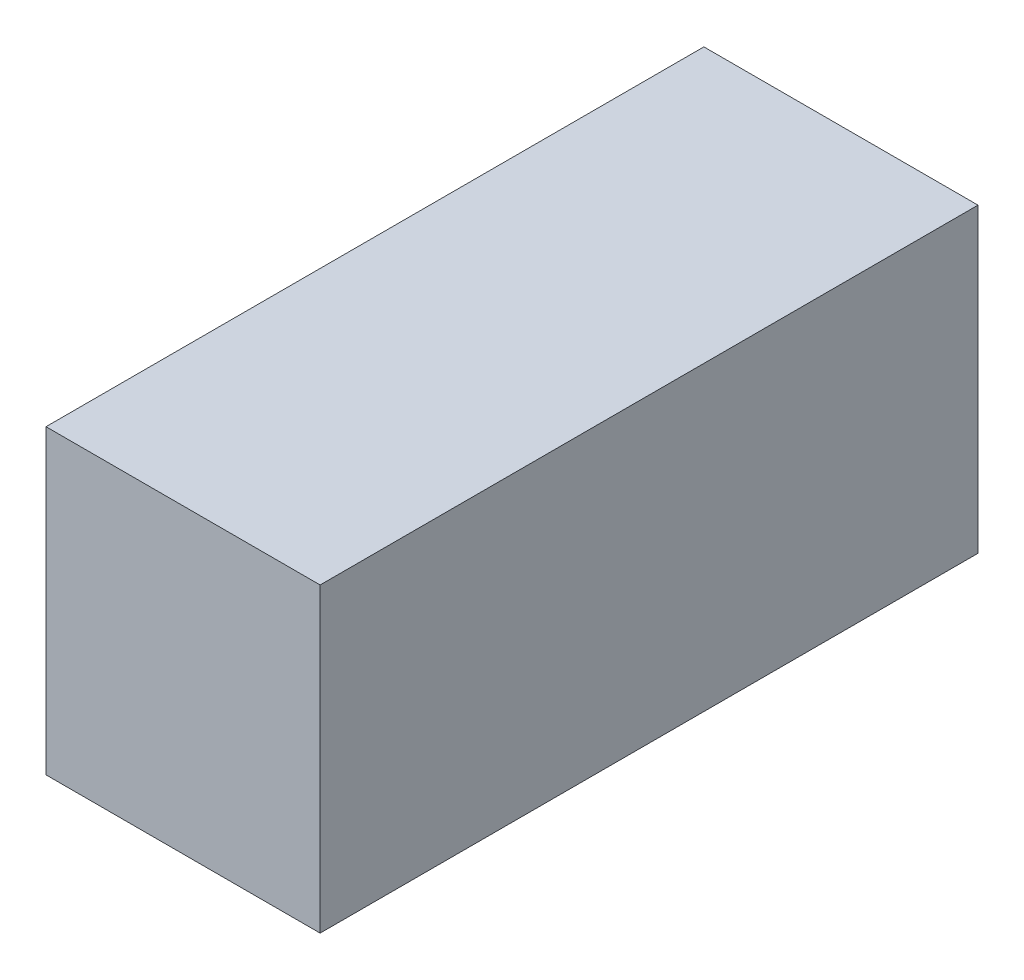
from build123d import *

# Parameters (mm, degrees)
SKETCH1_W           = 31.75
SKETCH1_H           = 76.2
BOSS_EXTRUDE1_DEPTH = 34.925


with BuildPart() as part:
    # Sketch1 → Boss-Extrude1 (new body)
    with BuildSketch(Plane(origin=(0, 0, 0), x_dir=(1, 0, 0), z_dir=(0, 1, 0))):
        Rectangle(SKETCH1_W, SKETCH1_H)
    extrude(amount=BOSS_EXTRUDE1_DEPTH)


solid = part.part
